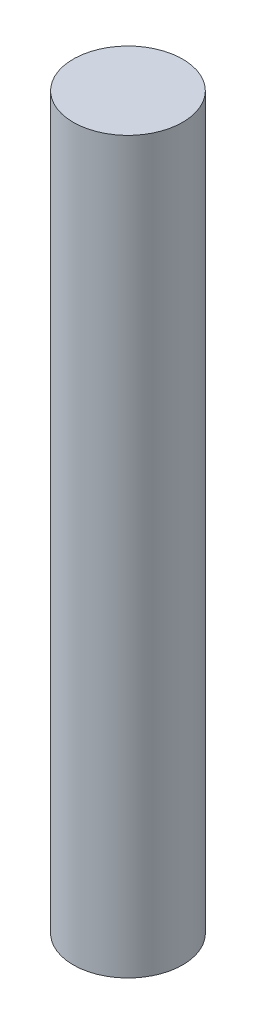
from build123d import *

# Parameters (mm, degrees)
SKETCH1_R           = 0.75
BOSS_EXTRUDE1_DEPTH = 10


with BuildPart() as part:
    # Sketch1 → Boss-Extrude1 (new body)
    with BuildSketch(Plane(origin=(0, 0, 0), x_dir=(1, 0, 0), z_dir=(0, 1, 0))):
        with Locations(Location((0, 0, 0), (0, 0, 270))):
            Circle(SKETCH1_R)
    extrude(amount=BOSS_EXTRUDE1_DEPTH)


solid = part.part
